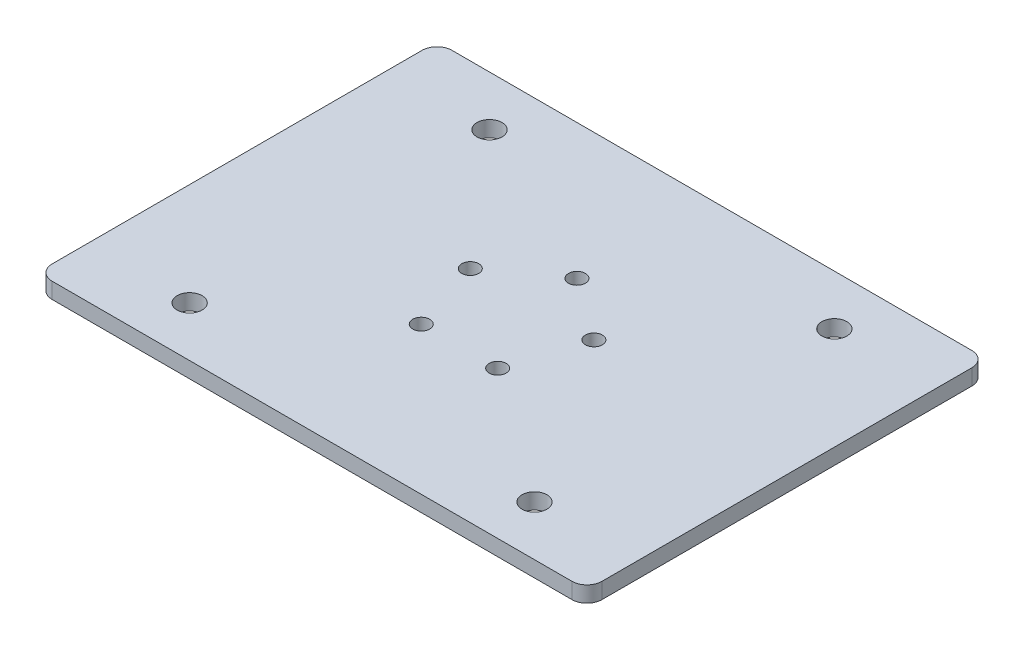
from build123d import *

# Parameters (mm, degrees)
CROQUIS1_R                       = 2.5
SALIENTE_EXTRUIR1_DEPTH          = 1.5875
TALADRO_DE_MARGEN_PARA_M31_D     = 3.4
TALADRO_DE_MARGEN_PARA_M31_DEPTH = 10
TALADRO_DE_MARGEN_PARA_M31_TIP   = 1.021463052


with BuildPart() as part:
    # Croquis1 → Saliente-Extruir1 (new, symmetric)
    with BuildSketch(Plane(origin=(0, 0, 0), x_dir=(1, 0, 0), z_dir=(0, 1, 0))):
        with BuildLine():
            Line((52, 40), (-52, 40))
            ThreePointArc((-52, 40), (-54.121320344, 39.121320344), (-55, 37))
            Line((-55, 37), (-55, -37))
            ThreePointArc((-55, -37), (-54.121320344, -39.121320344), (-52, -40))
            Line((-52, -40), (52, -40))
            ThreePointArc((52, -40), (54.121320344, -39.121320344), (55, -37))
            Line((55, -37), (55, 37))
            ThreePointArc((55, 37), (54.121320344, 39.121320344), (52, 40))
        make_face()
        with Locations(Location((34.5, 30, 0), (0, 0, 270))):
            Circle(CROQUIS1_R, mode=Mode.SUBTRACT)
        with Locations(Location((34.5, -30, 0), (0, 0, 270))):
            Circle(CROQUIS1_R, mode=Mode.SUBTRACT)
        with Locations(Location((-34.5, -30, 0), (0, 0, 270))):
            Circle(CROQUIS1_R, mode=Mode.SUBTRACT)
        with Locations(Location((-34.5, 30, 0), (0, 0, 270))):
            Circle(CROQUIS1_R, mode=Mode.SUBTRACT)
    extrude(amount=SALIENTE_EXTRUIR1_DEPTH, both=True)

    # Taladro de margen para M31
    with Locations(Plane(origin=(0, 1.5875, 0), x_dir=(1, 0, 0), z_dir=(0, 1, 0))):
        with Locations((0, 13), (12.363734712, 4.017220927), (7.64120828, -10.517220927), (-7.64120828, -10.517220927), (-12.363734712, 4.017220927)):
            Hole(TALADRO_DE_MARGEN_PARA_M31_D / 2, depth=TALADRO_DE_MARGEN_PARA_M31_DEPTH)
            with Locations((0, 0, -(TALADRO_DE_MARGEN_PARA_M31_DEPTH + TALADRO_DE_MARGEN_PARA_M31_TIP / 2))):  # 118° drill point
                Cone(0, TALADRO_DE_MARGEN_PARA_M31_D / 2, TALADRO_DE_MARGEN_PARA_M31_TIP, mode=Mode.SUBTRACT)


solid = part.part
